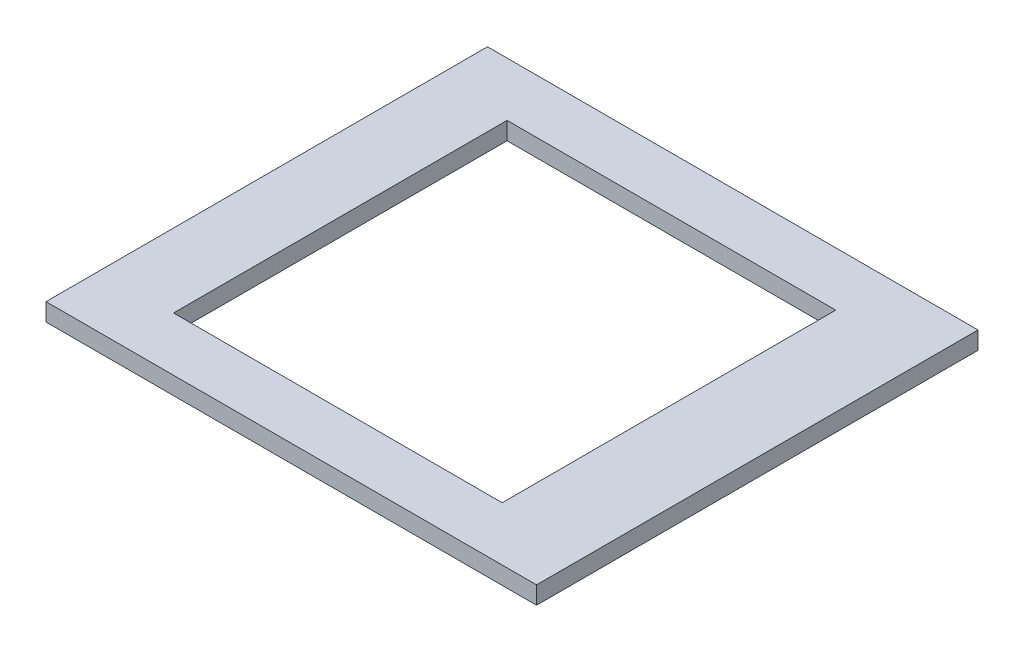
from build123d import *

# Parameters (mm, degrees)
SKETCH1_W           = 500
SKETCH1_H           = 450
SKETCH1_W_2         = 335
SKETCH1_H_2         = 340
BOSS_EXTRUDE1_DEPTH = 18


with BuildPart() as part:
    # Sketch1 → Boss-Extrude1 (new body)
    with BuildSketch(Plane(origin=(0, 0, 0), x_dir=(1, 0, 0), z_dir=(0, 1, 0))):
        with Locations((250, 225)):
            Rectangle(SKETCH1_W, SKETCH1_H)
        with Locations((242.5, 225)):
            Rectangle(SKETCH1_W_2, SKETCH1_H_2, mode=Mode.SUBTRACT)
    extrude(amount=BOSS_EXTRUDE1_DEPTH)


solid = part.part
